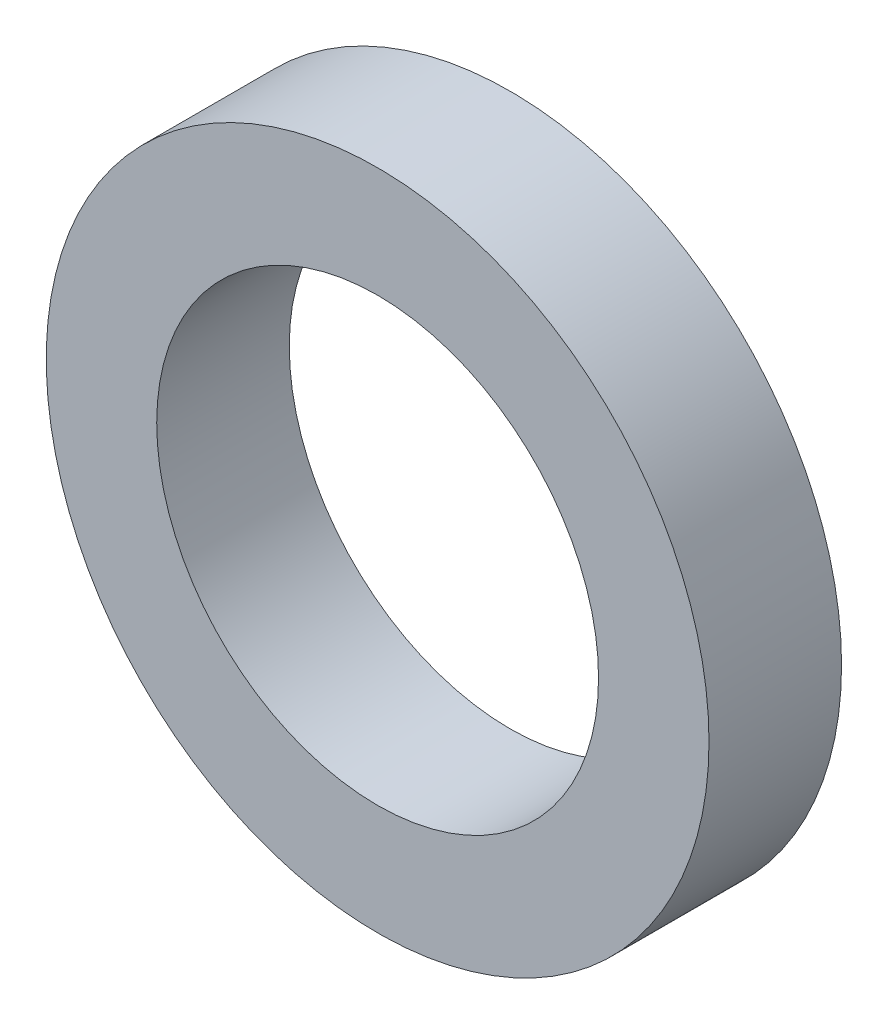
from build123d import *

# Parameters (mm, degrees)
SKETCH_1_R      = 7.5
SKETCH_1_R_2    = 5
EXTRUDE_1_DEPTH = 3


with BuildPart() as part:
    # 草图1 → 凸台-拉伸1 (new body)
    with BuildSketch(Plane.XY):
        Circle(SKETCH_1_R)
        Circle(SKETCH_1_R_2, mode=Mode.SUBTRACT)
    extrude(amount=EXTRUDE_1_DEPTH)


solid = part.part
